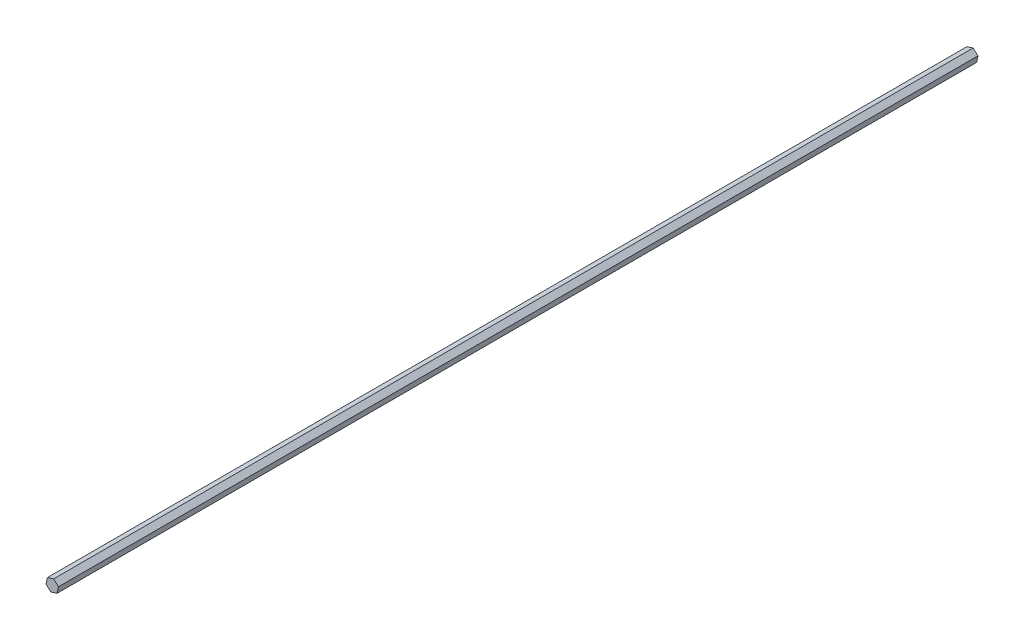
from build123d import *

# Parameters (mm, degrees)
BOSS_EXTRUDE1_DEPTH = 405


with BuildPart() as part:
    # Sketch1 → Boss-Extrude1 (new body)
    with BuildSketch(Plane.XY):
        Polygon((2.137295047, -1.940438924), (2.749116926, 0.880732344), (0.611821879, 2.821171268), (-2.137295047, 1.940438924), (-2.749116926, -0.880732344), (-0.611821879, -2.821171268), align=None)
    extrude(amount=BOSS_EXTRUDE1_DEPTH)


solid = part.part
